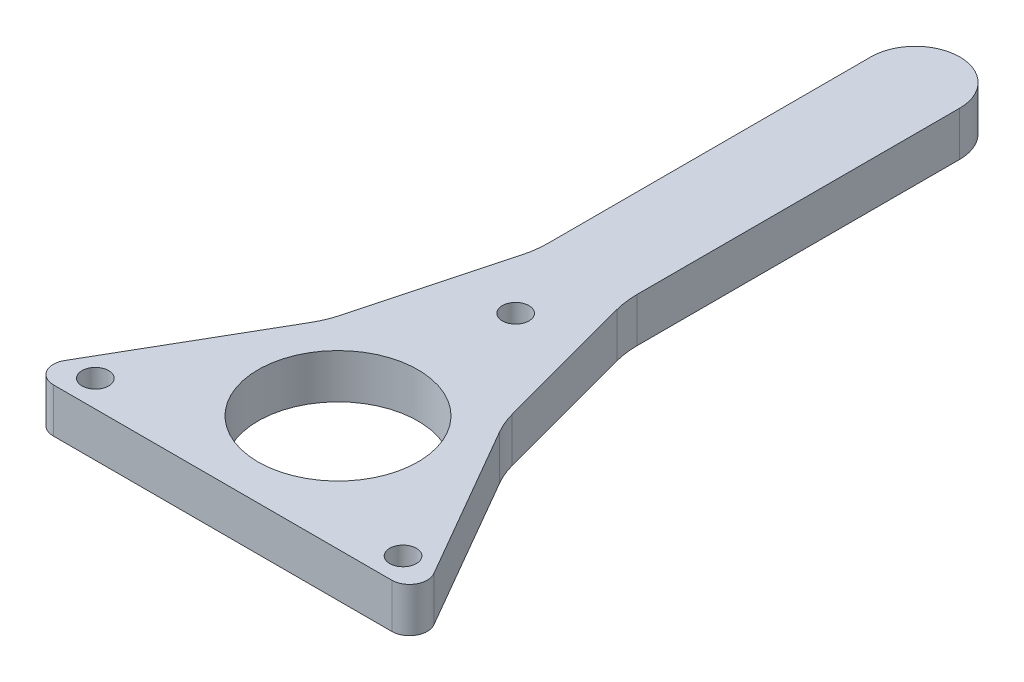
from build123d import *

# Parameters (mm, degrees)
SKETCH_1_R      = 9
SKETCH_1_R_2    = 1.5
EXTRUDE_1_DEPTH = 5
FILLET_1_R      = 2
CHAMFER_1_SIZE  = 10
FILLET_3_R      = 10


with BuildPart() as part:
    # 草图1 → 凸台-拉伸1 (new body)
    with BuildSketch(Plane(origin=(0, 0, 0), x_dir=(1, 0, 0), z_dir=(0, 1, 0))):
        with BuildLine():
            Line((5, 17.339745962), (5, 65))
            ThreePointArc((5, 65), (0, 70), (-5, 65))
            Line((-5, 65), (-5, 17.339745962))
            Line((-5, 17.339745962), (-22.516660498, -13))
            Line((-22.516660498, -13), (22.516660498, -13))
            Line((22.516660498, -13), (5, 17.339745962))
        make_face()
        with Locations(Location((0, 0, 0), (0, 0, 270))):
            Circle(SKETCH_1_R, mode=Mode.SUBTRACT)
        with Locations(Location((0, 20, 0), (0, 0, 270))):
            Circle(SKETCH_1_R_2, mode=Mode.SUBTRACT)
        with Locations(Location((-17.320508076, -10, 0), (0, 0, 270))):
            Circle(SKETCH_1_R_2, mode=Mode.SUBTRACT)
        with Locations(Location((17.320508076, -10, 0), (0, 0, 270))):
            Circle(SKETCH_1_R_2, mode=Mode.SUBTRACT)
    extrude(amount=EXTRUDE_1_DEPTH)

    # 圆角1
    fillet_1_edges = [part.edges().sort_by_distance(p)[0] for p in [
        (22.516660498, 2.5, 13),
        (-22.516660498, 2.5, 13),
    ]]
    fillet(fillet_1_edges, radius=FILLET_1_R)

    # 倒角1
    chamfer_1_edges = [part.edges().sort_by_distance(p)[0] for p in [
        (-5, 2.5, -17.339745962),
        (5, 2.5, -17.339745962),
    ]]
    chamfer(chamfer_1_edges, length=CHAMFER_1_SIZE)

    # 圆角3
    fillet_3_edges = [part.edges().sort_by_distance(p)[0] for p in [
        (5, 2.5, -27.339745962),
        (10, 2.5, -8.679491924),
        (-10, 2.5, -8.679491924),
        (-5, 2.5, -27.339745962),
    ]]
    fillet(fillet_3_edges, radius=FILLET_3_R)


solid = part.part
